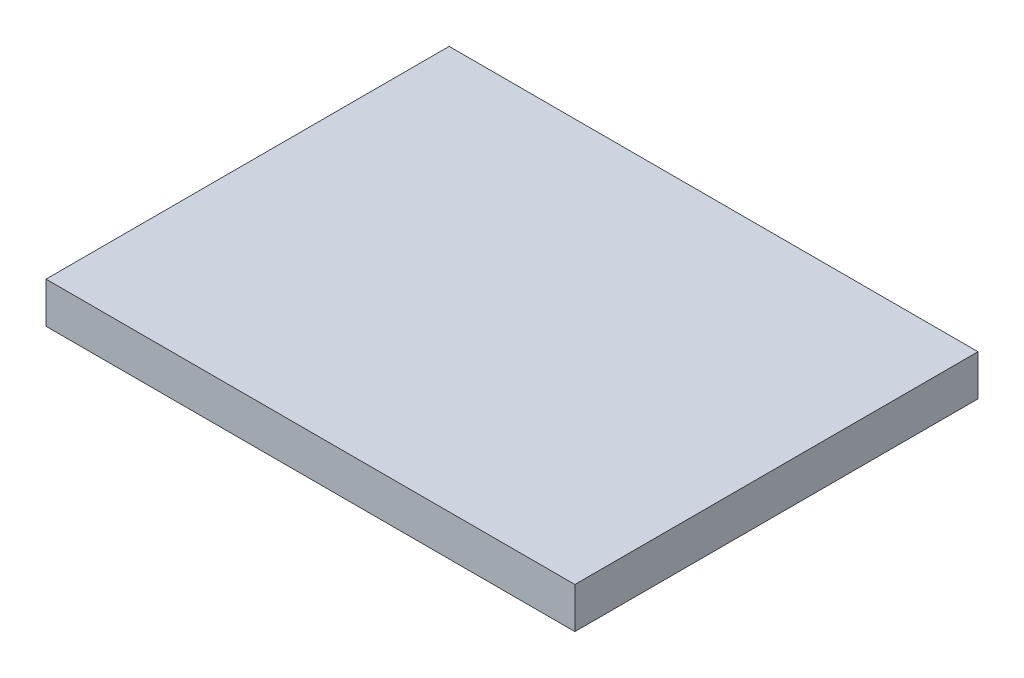
from build123d import *

# Parameters (mm, degrees)
SKETCH1_W           = 129.51492599
SKETCH1_H           = 98.721167364
BOSS_EXTRUDE1_DEPTH = 10


with BuildPart() as part:
    # Sketch1 → Boss-Extrude1 (new body)
    with BuildSketch(Plane(origin=(0, 0, 0), x_dir=(1, 0, 0), z_dir=(0, 1, 0))):
        Rectangle(SKETCH1_W, SKETCH1_H)
    extrude(amount=BOSS_EXTRUDE1_DEPTH)


solid = part.part
